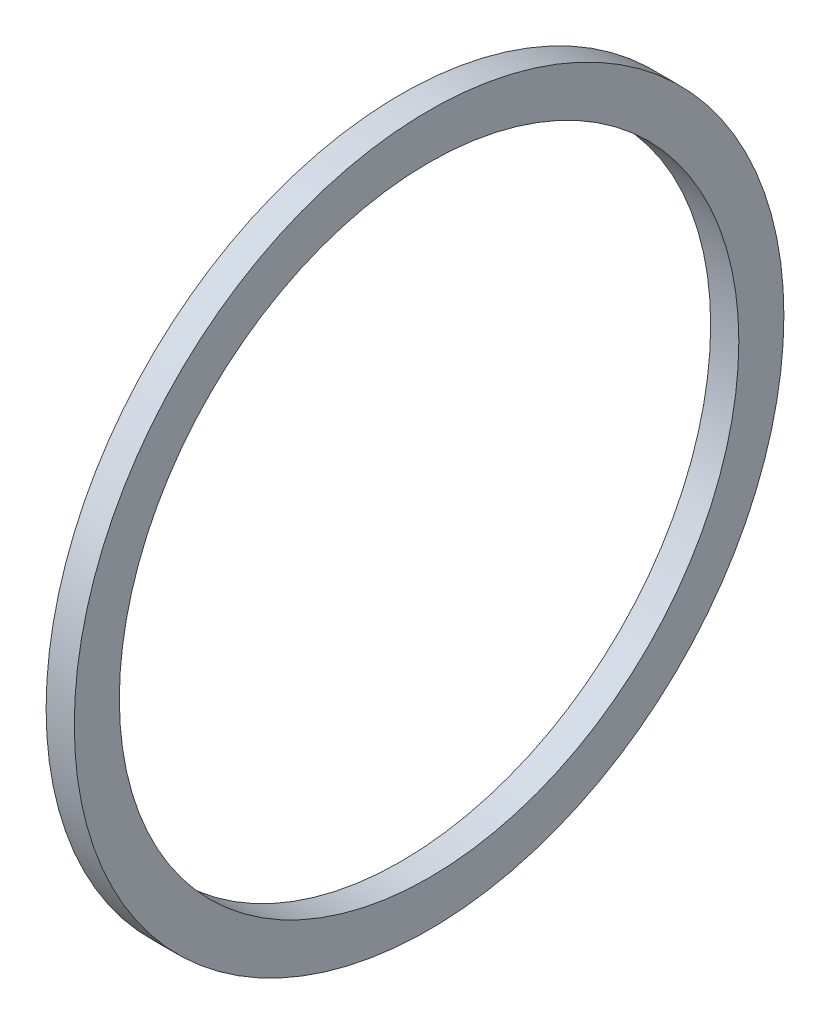
from build123d import *

# Parameters (mm, degrees)
SKETCH1_R           = 18.9
SKETCH1_R_2         = 16.5
BOSS_EXTRUDE1_DEPTH = 1.5


with BuildPart() as part:
    # Sketch1 → Boss-Extrude1 (new body)
    with BuildSketch(Plane(origin=(0, 0, 0), x_dir=(0, 0, -1), z_dir=(1, 0, 0))):
        Circle(SKETCH1_R)
        Circle(SKETCH1_R_2, mode=Mode.SUBTRACT)
    extrude(amount=BOSS_EXTRUDE1_DEPTH)


solid = part.part
